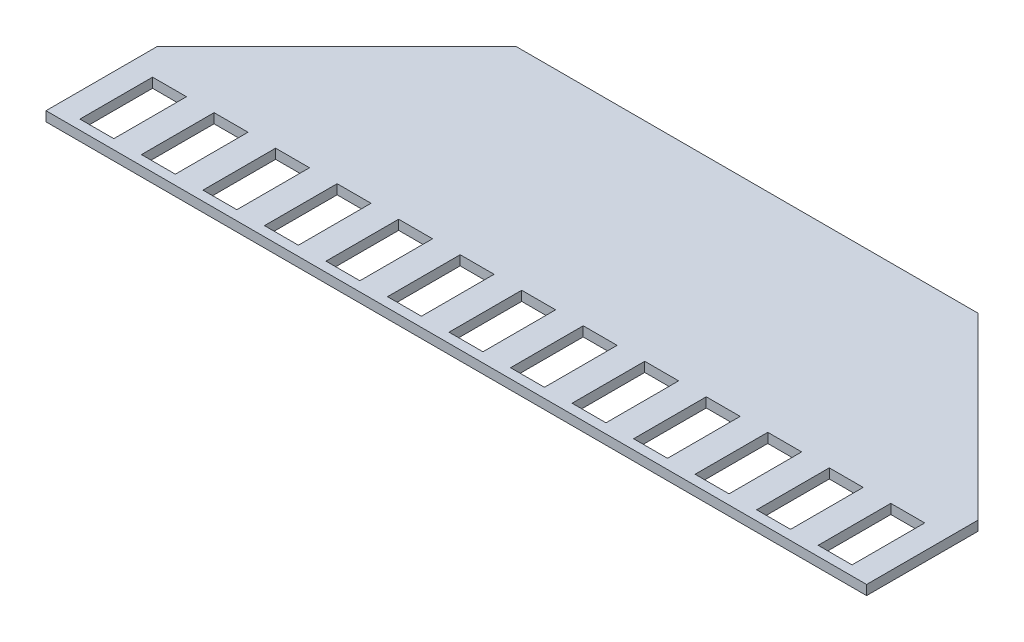
from build123d import *

# Parameters (mm, degrees)
SKETCH_1_W      = 0.7
SKETCH_1_H      = 1.5
EXTRUDE_1_DEPTH = 0.2


with BuildPart() as part:
    # 스케치1 → 보스-돌출1 (new body)
    with BuildSketch(Plane.XZ):
        Polygon((28.47, -5.1), (24.77, -8.8), (15.23, -8.8), (11.53, -5.1), (11.53, -2.8), (28.47, -2.8), align=None)
        with Locations((12.38, -3.75)):
            Rectangle(SKETCH_1_W, SKETCH_1_H, mode=Mode.SUBTRACT)
        with Locations((13.65, -3.75)):
            Rectangle(SKETCH_1_W, SKETCH_1_H, mode=Mode.SUBTRACT)
        with Locations((14.92, -3.75)):
            Rectangle(SKETCH_1_W, SKETCH_1_H, mode=Mode.SUBTRACT)
        with Locations((16.19, -3.75)):
            Rectangle(SKETCH_1_W, SKETCH_1_H, mode=Mode.SUBTRACT)
        with Locations((17.46, -3.75)):
            Rectangle(SKETCH_1_W, SKETCH_1_H, mode=Mode.SUBTRACT)
        with Locations((18.73, -3.75)):
            Rectangle(SKETCH_1_W, SKETCH_1_H, mode=Mode.SUBTRACT)
        with Locations((20, -3.75)):
            Rectangle(SKETCH_1_W, SKETCH_1_H, mode=Mode.SUBTRACT)
        with Locations((21.27, -3.75)):
            Rectangle(SKETCH_1_W, SKETCH_1_H, mode=Mode.SUBTRACT)
        with Locations((22.54, -3.75)):
            Rectangle(SKETCH_1_W, SKETCH_1_H, mode=Mode.SUBTRACT)
        with Locations((23.81, -3.75)):
            Rectangle(SKETCH_1_W, SKETCH_1_H, mode=Mode.SUBTRACT)
        with Locations((25.08, -3.75)):
            Rectangle(SKETCH_1_W, SKETCH_1_H, mode=Mode.SUBTRACT)
        with Locations((26.35, -3.75)):
            Rectangle(SKETCH_1_W, SKETCH_1_H, mode=Mode.SUBTRACT)
        with Locations((27.62, -3.75)):
            Rectangle(SKETCH_1_W, SKETCH_1_H, mode=Mode.SUBTRACT)
    extrude(amount=EXTRUDE_1_DEPTH)


solid = part.part
